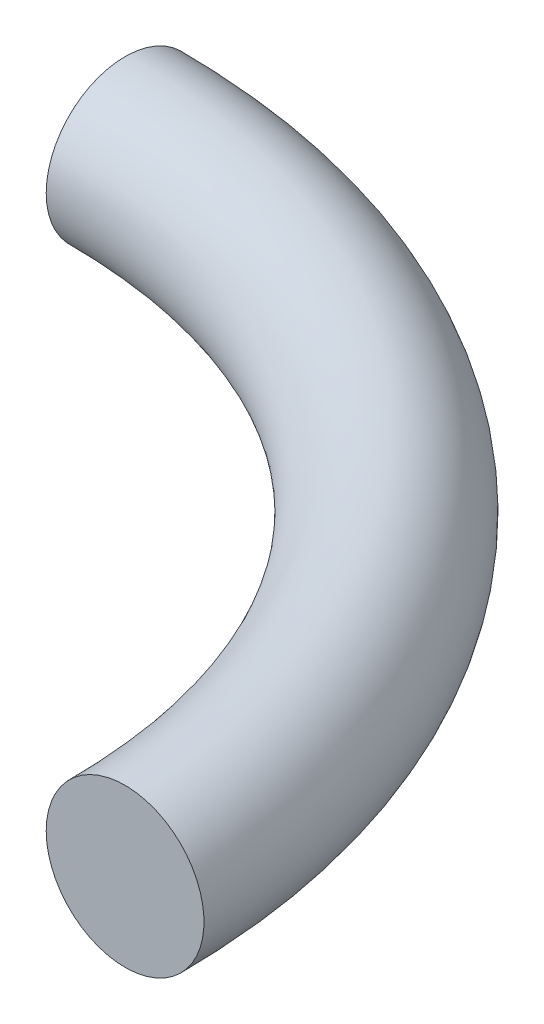
from build123d import *

# Parameters (mm, degrees)
SWEEP1_PROFILE_R = 6.35


with BuildPart() as part:
    # Sweep1: sweep along a path in Sketch1
    with BuildLine(Plane(origin=(0, 0, 0), x_dir=(1, 0, 0), z_dir=(0, 1, 0))) as sweep1_path:
        ThreePointArc((50.8, 0), (35.921024484, 35.921024484), (0, 50.8))
    # Sweep1 profile (on start of the path) → Sweep1 (sweep)
    with BuildSketch(Plane(origin=(50.8, 0, 0), x_dir=(-1, 0, 0), z_dir=(0, 0, -1))):
        Circle(SWEEP1_PROFILE_R)
    sweep(path=sweep1_path.line)


solid = part.part
